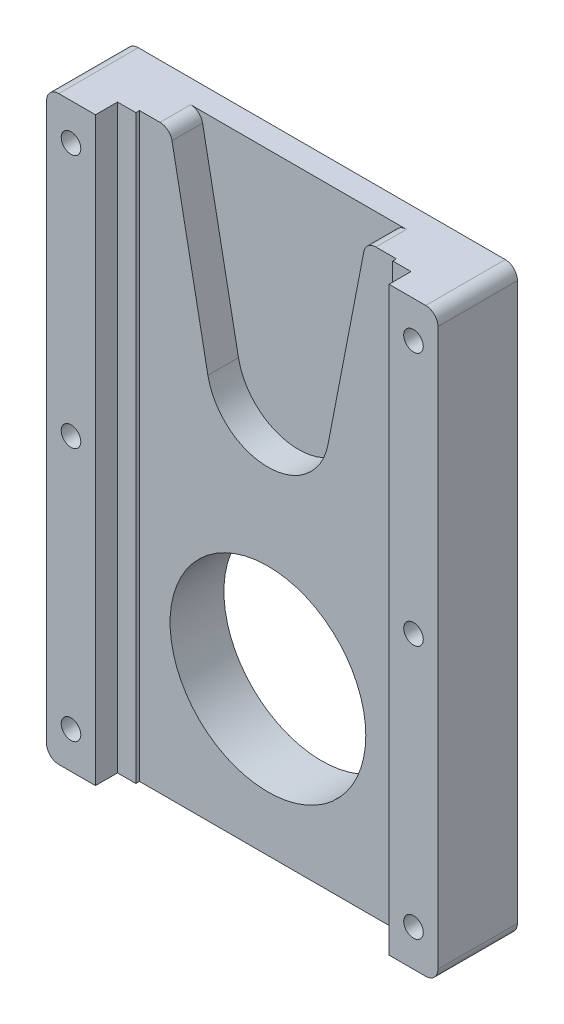
from build123d import *
from build123d.topology import SkipClean

# Parameters (mm, degrees)
ESQUISSE1_W             = 64
ESQUISSE1_H             = 95
ESQUISSE1_R             = 16
BOSS_EXTRU_1_DEPTH      = 12
ESQUISSE2_W             = 48
ESQUISSE2_H             = 95
ENL_V_MAT_EXTRU_1_DEPTH = 2.6
ESQUISSE3_W             = 42
ESQUISSE3_H             = 95
ENL_V_MAT_EXTRU_2_DEPTH = 0.6
ESQUISSE4_R             = 1.6
ENL_V_MAT_EXTRU_4_DEPTH = 78.897368377
ENL_V_MAT_EXTRU_5_DEPTH = 5
CONG_1_R                = 2
BOSS_EXTRU_2_START      = 1
ESQUISSE6_R             = 1.6
BOSS_EXTRU_2_DEPTH      = 1


with BuildPart() as part:
    # Esquisse1 → Boss.-Extru.1 (new body)
    with BuildSketch(Plane.XY):
        with Locations((0, 22.5)):
            Rectangle(ESQUISSE1_W, ESQUISSE1_H)
        Circle(ESQUISSE1_R, mode=Mode.SUBTRACT)
    extrude(amount=-BOSS_EXTRU_1_DEPTH)

    # Esquisse2 → Enlèv. mat.-Extru.1 (cut)
    with BuildSketch(Plane.XY):
        with Locations((0, 22.5)):
            Rectangle(ESQUISSE2_W, ESQUISSE2_H)
    extrude(amount=-ENL_V_MAT_EXTRU_1_DEPTH, mode=Mode.SUBTRACT)

    # Esquisse3 → Enlèv. mat.-Extru.2 (cut)
    with BuildSketch(Plane.XY.offset(-2.6)):
        with Locations((0, 22.5)):
            Rectangle(ESQUISSE3_W, ESQUISSE3_H)
    extrude(amount=-ENL_V_MAT_EXTRU_2_DEPTH, mode=Mode.SUBTRACT)

    # Esquisse4 → Enlèv. mat.-Extru.4 (cut, through all)
    with BuildSketch(Plane.XY):
        with Locations((-28, -19)):
            Circle(ESQUISSE4_R)
        with Locations((-28, 22.5)):
            Circle(ESQUISSE4_R)
        with Locations((-28, 64)):
            Circle(ESQUISSE4_R)
    enl_v_mat_extru_4 = extrude(amount=-ENL_V_MAT_EXTRU_4_DEPTH, mode=Mode.SUBTRACT)

    # Symétrie1: Enlèv. mat.-Extru.4 across plane
    add(enl_v_mat_extru_4.mirror(Plane(origin=(0, 0, 0), x_dir=(0, 0, 1), z_dir=(1, 0, 0))), mode=Mode.SUBTRACT)

    # Esquisse5 → Enlèv. mat.-Extru.5 (cut)
    with BuildSketch(Plane.XY.offset(-3.2)):
        with BuildLine():
            Line((16, 70), (9.817340904, 38.097418184))
            ThreePointArc((9.817340904, 38.097418184), (0, 30), (-9.817340904, 38.097418184))
            Line((-9.817340904, 38.097418184), (-16, 70))
            Line((-16, 70), (16, 70))
        make_face()
    extrude(amount=-ENL_V_MAT_EXTRU_5_DEPTH, mode=Mode.SUBTRACT)

    # Congé1
    cong_1_edges = [part.edges().sort_by_distance(p)[0] for p in [
        (-32, 70, -6),
        (32, 70, -6),
        (32, -25, -6),
        (-32, -25, -6),
        (-16, 70, -5.7),
        (16, 70, -5.7),
    ]]
    fillet(cong_1_edges, radius=CONG_1_R)

    # Esquisse6 → Boss.-Extru.2 (add)
    # profile 1 of 2: a face of its own
    with SkipClean():  # the faces are left unmerged after this step: merging them gives an invalid solid
        with BuildSketch(Plane.XY.offset(BOSS_EXTRU_2_START)):
            with BuildLine():
                Line((-32, 68), (-32, -23))
                ThreePointArc((-32, -23), (-31.414213562, -24.414213562), (-30, -25))
                Line((-30, -25), (-24, -25))
                Line((-24, -25), (-24, 70))
                Line((-24, 70), (-30, 70))
                ThreePointArc((-30, 70), (-31.414213562, 69.414213562), (-32, 68))
            make_face()
            with Locations((-28, 64)):
                Circle(ESQUISSE6_R, mode=Mode.SUBTRACT)
            with Locations((-28, 22.5)):
                Circle(ESQUISSE6_R, mode=Mode.SUBTRACT)
            with Locations((-28, -19)):
                Circle(ESQUISSE6_R, mode=Mode.SUBTRACT)
        # profile 2 of 2: a face of its own
        with BuildSketch(Plane.XY.offset(BOSS_EXTRU_2_START)):
            with BuildLine():
                Line((32, -23), (32, 68))
                ThreePointArc((32, 68), (31.414213562, 69.414213562), (30, 70))
                Line((30, 70), (24, 70))
                Line((24, 70), (24, -25))
                Line((24, -25), (30, -25))
                ThreePointArc((30, -25), (31.414213562, -24.414213562), (32, -23))
            make_face()
            with Locations((28, -19)):
                Circle(ESQUISSE6_R, mode=Mode.SUBTRACT)
            with Locations((28, 22.5)):
                Circle(ESQUISSE6_R, mode=Mode.SUBTRACT)
            with Locations((28, 64)):
                Circle(ESQUISSE6_R, mode=Mode.SUBTRACT)
        extrude(amount=-BOSS_EXTRU_2_DEPTH)


solid = part.part
